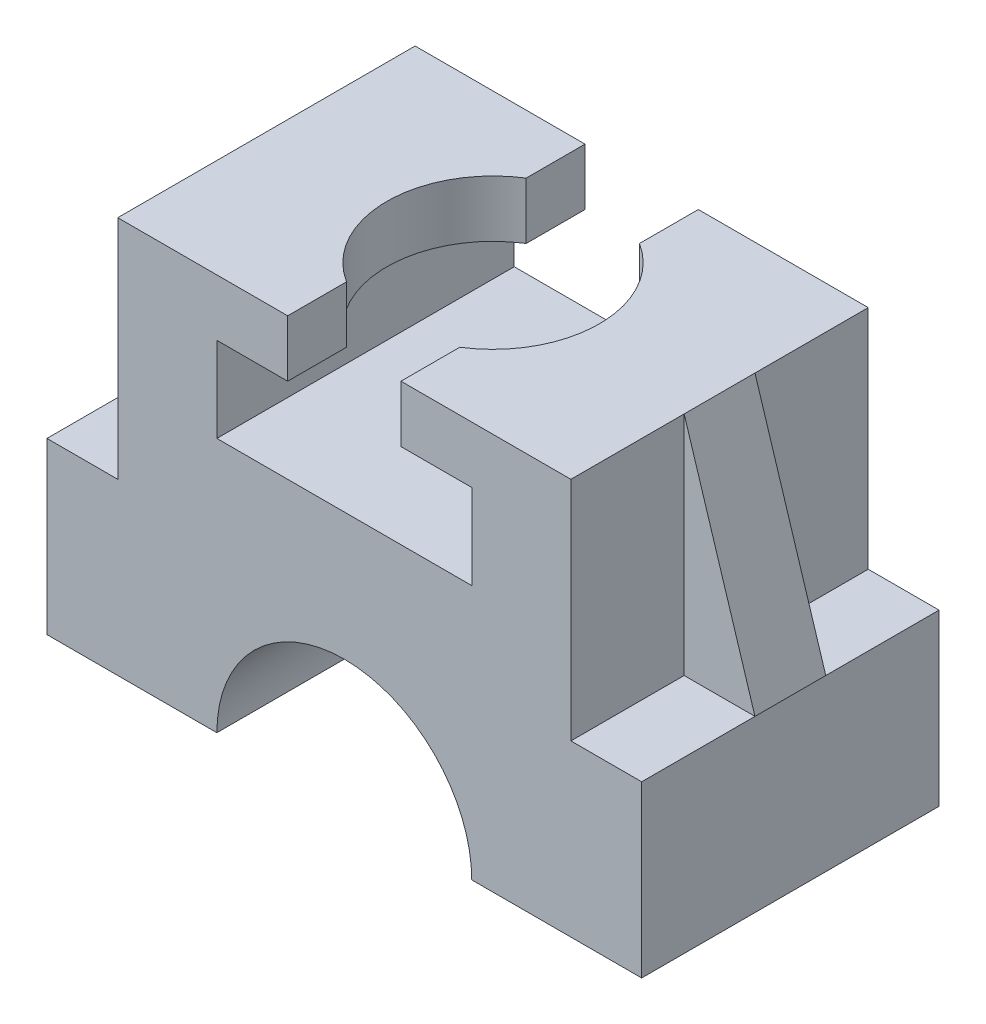
from build123d import *

# Parameters (mm, degrees)
BOSS_EXTRUDE1_DEPTH = 105
SKETCH2_R           = 37.5
CUT_EXTRUDE1_DEPTH  = 20
SKETCH3_W           = 25
SKETCH3_H           = 80
BOSS_EXTRUDE2_DEPTH = 25
SKETCH5_W           = 25
SKETCH5_H           = 80
BOSS_EXTRUDE3_DEPTH = 25
CUT_EXTRUDE2_DEPTH  = 25


with BuildPart() as part:
    # Sketch1 → Boss-Extrude1 (new body)
    with BuildSketch(Plane.XY):
        with BuildLine():
            Line((-80, 80), (-80, 0))
            Line((-80, 0), (-105, 0))
            Line((-105, 0), (-105, -60))
            Line((-105, -60), (-45, -60))
            ThreePointArc((-45, -60), (0, -15), (45, -60))
            Line((45, -60), (105, -60))
            Line((105, -60), (105, 0))
            Line((105, 0), (80, 0))
            Line((80, 0), (80, 80))
            Line((80, 80), (20, 80))
            Line((20, 80), (20, 60))
            Line((20, 60), (45, 60))
            Line((45, 60), (45, 30))
            Line((45, 30), (-45, 30))
            Line((-45, 30), (-45, 60))
            Line((-45, 60), (-20, 60))
            Line((-20, 60), (-20, 80))
            Line((-20, 80), (-80, 80))
        make_face()
    extrude(amount=-BOSS_EXTRUDE1_DEPTH)

    # Sketch2 → Cut-Extrude1 (cut)
    with BuildSketch(Plane(origin=(0, 80, 0), x_dir=(1, 0, 0), z_dir=(0, 1, 0))):
        with Locations((0, 52.5)):
            Circle(SKETCH2_R)
    extrude(amount=-CUT_EXTRUDE1_DEPTH, mode=Mode.SUBTRACT)

    # Sketch3 → Boss-Extrude2 (add)
    with BuildSketch(Plane(origin=(80, 0, 0), x_dir=(0, 0, -1), z_dir=(1, 0, 0))):
        with Locations((52.5, 40)):
            Rectangle(SKETCH3_W, SKETCH3_H)
    extrude(amount=BOSS_EXTRUDE2_DEPTH)

    # Sketch5 → Boss-Extrude3 (add)
    with BuildSketch(Plane.ZY.offset(80)):
        with Locations((-52.5, 40)):
            Rectangle(SKETCH5_W, SKETCH5_H)
    extrude(amount=BOSS_EXTRUDE3_DEPTH)

    # Sketch6 → Cut-Extrude2 (cut)
    with BuildSketch(Plane(origin=(0, 0, -65), x_dir=(-1, 0, 0), z_dir=(0, 0, -1))):
        Polygon((80, 80), (105, 80), (105, 0), align=None)
        Polygon((-105, 0), (-105, 80), (-80, 80), align=None)
    extrude(amount=-CUT_EXTRUDE2_DEPTH, mode=Mode.SUBTRACT)


solid = part.part
